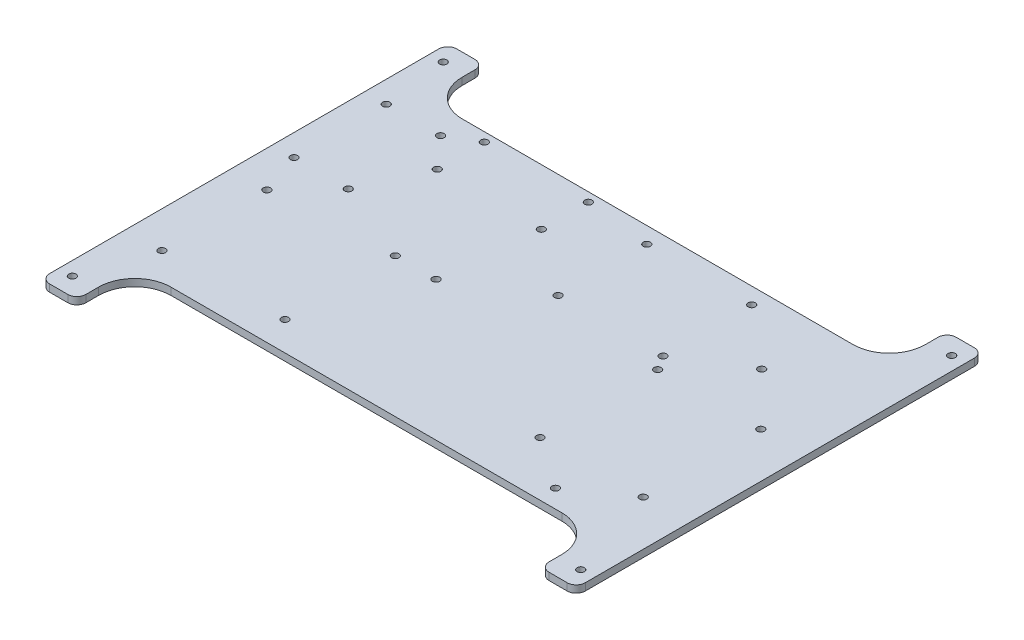
from build123d import *

# Parameters (mm, degrees)
BOSS_EXTRUDE1_DEPTH = 4
FILLET1_R           = 5
FILLET2_R           = 20
SKETCH3_R           = 2
CUT_EXTRUDE1_DEPTH  = 5
SKETCH4_R           = 2
CUT_EXTRUDE2_DEPTH  = 10
SKETCH5_W           = 262
SKETCH5_H           = 8
BOSS_EXTRUDE2_DEPTH = 4


with BuildPart() as part:
    # Sketch1 → Boss-Extrude1 (new body)
    with BuildSketch(Plane(origin=(0, 0, 0), x_dir=(1, 0, 0), z_dir=(0, 1, 0))):
        Polygon((128, 112.5), (148, 112.5), (148, -112.5), (128, -112.5), (128, -80.5), (-128, -80.5), (-128, -112.5), (-148, -112.5), (-148, 112.5), (-128, 112.5), (-128, 80.5), (128, 80.5), align=None)
    extrude(amount=BOSS_EXTRUDE1_DEPTH)

    # Fillet1
    fillet1_edges = [part.edges().sort_by_distance(p)[0] for p in [
        (148, 2, 112.5),
        (128, 2, 112.5),
        (-128, 2, 112.5),
        (-148, 2, 112.5),
        (-148, 2, -112.5),
        (-128, 2, -112.5),
        (128, 2, -112.5),
        (148, 2, -112.5),
    ]]
    fillet(fillet1_edges, radius=FILLET1_R)

    # Fillet2
    fillet2_edges = [part.edges().sort_by_distance(p)[0] for p in [
        (128, 2, 80.5),
        (-128, 2, 80.5),
        (-128, 2, -80.5),
        (128, 2, -80.5),
    ]]
    fillet(fillet2_edges, radius=FILLET2_R)

    # Sketch3 → Cut-Extrude1 (cut)
    with BuildSketch(Plane(origin=(0, 4, 0), x_dir=(1, 0, 0), z_dir=(0, 1, 0))):
        with Locations(Location((-140.5, 102.5, 0), (0, 0, 270))):
            Circle(SKETCH3_R)
        with Locations(Location((140.5, 102.5, 0), (0, 0, 270))):
            Circle(SKETCH3_R)
        with Locations(Location((140.5, -102.5, 0), (0, 0, 270))):
            Circle(SKETCH3_R)
        with Locations(Location((-140.5, -102.5, 0), (0, 0, 270))):
            Circle(SKETCH3_R)
    extrude(amount=-CUT_EXTRUDE1_DEPTH, mode=Mode.SUBTRACT)

    # Sketch4 → Cut-Extrude2 (cut)
    with BuildSketch(Plane(origin=(0, 4, 0), x_dir=(1, 0, 0), z_dir=(0, 1, 0))):
        with Locations(Location((-136, 66.5, 0), (0, 0, 270))):
            Circle(SKETCH4_R)
        with Locations(Location((-136, 15.5, 0), (0, 0, 270))):
            Circle(SKETCH4_R)
        with Locations(Location((-106, 15.5, 0), (0, 0, 270))):
            Circle(SKETCH4_R)
        with Locations(Location((-106, 66.5, 0), (0, 0, 270))):
            Circle(SKETCH4_R)
        with Locations(Location((-90.8, 75.5, 0), (0, 0, 270))):
            Circle(SKETCH4_R)
        with Locations(Location((-90.8, 49.5, 0), (0, 0, 270))):
            Circle(SKETCH4_R)
        with Locations(Location((-33.3, 75.5, 0), (0, 0, 270))):
            Circle(SKETCH4_R)
        with Locations(Location((-33.3, 49.5, 0), (0, 0, 270))):
            Circle(SKETCH4_R)
        with Locations(Location((3, 71.5, 0), (0, 0, 270))):
            Circle(SKETCH4_R)
        with Locations(Location((61, 71.5, 0), (0, 0, 270))):
            Circle(SKETCH4_R)
        with Locations(Location((61, 22.5, 0), (0, 0, 270))):
            Circle(SKETCH4_R)
        with Locations(Location((3, 22.5, 0), (0, 0, 270))):
            Circle(SKETCH4_R)
        with Locations(Location((66, 14.5, 0), (0, 0, 270))):
            Circle(SKETCH4_R)
        with Locations(Location((123, 14.5, 0), (0, 0, 270))):
            Circle(SKETCH4_R)
        with Locations(Location((123, -50.5, 0), (0, 0, 270))):
            Circle(SKETCH4_R)
        with Locations(Location((66, -50.5, 0), (0, 0, 270))):
            Circle(SKETCH4_R)
        with Locations(Location((94.5, 43.5, 0), (0, 0, 270))):
            Circle(SKETCH4_R)
        with Locations(Location((94.5, -70.5, 0), (0, 0, 270))):
            Circle(SKETCH4_R)
        with Locations(Location((-128, -7.5, 0), (0, 0, 270))):
            Circle(SKETCH4_R)
        with Locations(Location((-128, -65.5, 0), (0, 0, 270))):
            Circle(SKETCH4_R)
        with Locations(Location((-61, -64.5, 0), (0, 0, 270))):
            Circle(SKETCH4_R)
        with Locations(Location((-61, -3.5, 0), (0, 0, 270))):
            Circle(SKETCH4_R)
        with Locations(Location((-38.5, -3.5, 0), (0, 0, 270))):
            Circle(SKETCH4_R)
    extrude(amount=-CUT_EXTRUDE2_DEPTH, mode=Mode.SUBTRACT)

    # Sketch5 → Boss-Extrude2 (add)
    with BuildSketch(Plane.XZ):
        with Locations((0, 40.5)):
            Rectangle(SKETCH5_W, SKETCH5_H)
        with Locations((0, -5.5)):
            Rectangle(SKETCH5_W, SKETCH5_H)
        with Locations((0, -57.5)):
            Rectangle(SKETCH5_W, SKETCH5_H)
    extrude(amount=BOSS_EXTRUDE2_DEPTH)


solid = part.part
